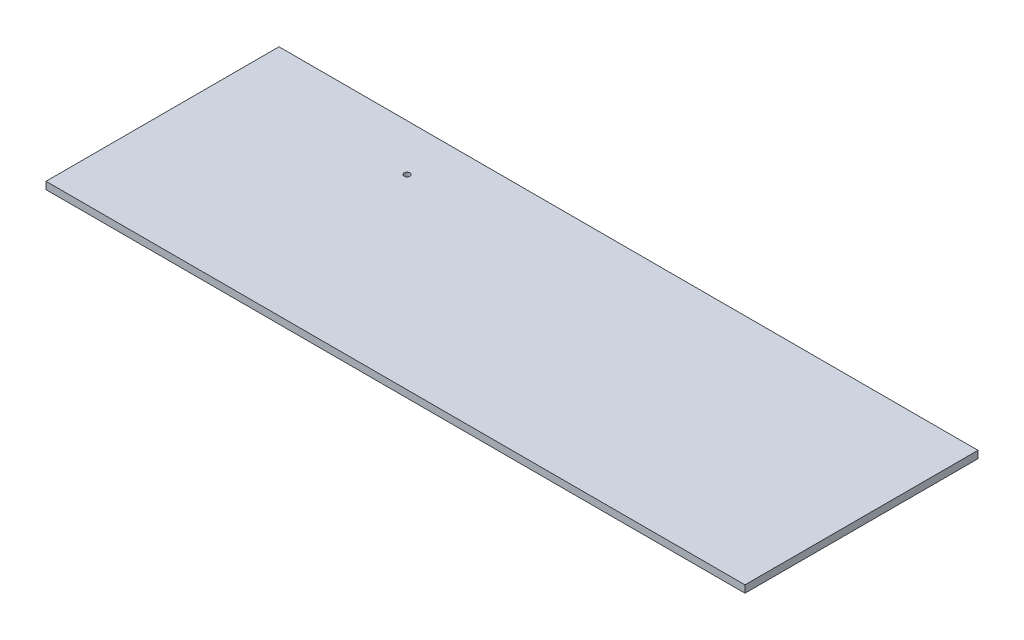
from build123d import *

# Parameters (mm, degrees)
SKETCH1_W           = 304.8
SKETCH1_H           = 101.6
BOSS_EXTRUDE1_DEPTH = 3.175
SKETCH3_R           = 1.27
CUT_EXTRUDE1_DEPTH  = 2.54
SKETCH4_R           = 1.302859954
CUT_EXTRUDE2_DEPTH  = 12.7


with BuildPart() as part:
    # Sketch1 → Boss-Extrude1 (new body)
    with BuildSketch(Plane(origin=(0, 0, 0), x_dir=(1, 0, 0), z_dir=(0, 1, 0))):
        with Locations((152.4, -50.8)):
            Rectangle(SKETCH1_W, SKETCH1_H)
    extrude(amount=BOSS_EXTRUDE1_DEPTH)

    # Sketch3 → Cut-Extrude1 (cut)
    with BuildSketch(Plane(origin=(0, 3.175, 0), x_dir=(1, 0, 0), z_dir=(0, 1, 0))):
        with Locations(Location((76.2, -20.32, 0), (0, 0, 270))):
            Circle(SKETCH3_R)
    extrude(amount=-CUT_EXTRUDE1_DEPTH, mode=Mode.SUBTRACT)

    # Sketch4 → Cut-Extrude2 (cut)
    with BuildSketch(Plane(origin=(0, 0.635, 0), x_dir=(1, 0, 0), z_dir=(0, 1, 0))):
        with Locations(Location((76.2, -20.32, 0), (0, 0, 270))):
            Circle(SKETCH4_R)
    extrude(amount=-CUT_EXTRUDE2_DEPTH, mode=Mode.SUBTRACT)


solid = part.part
